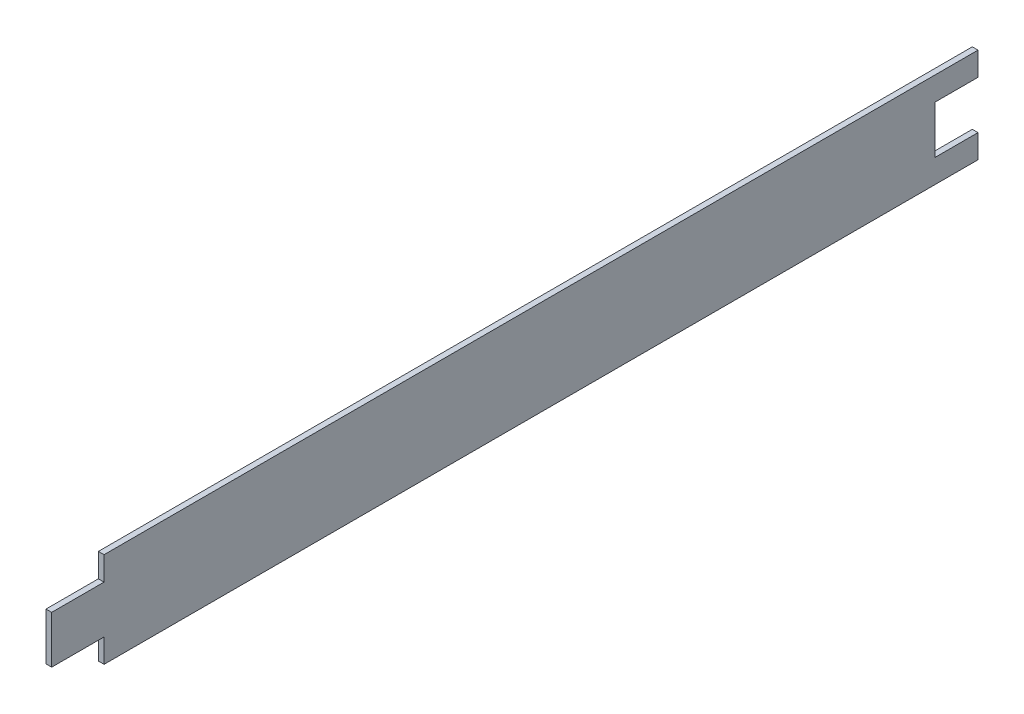
from build123d import *

# Parameters (mm, degrees)
ESQUISSE2_W        = 27.56942971
ESQUISSE2_H        = 25
BOSS_EXTRU_3_DEPTH = 3


with BuildPart() as part:
    # Esquisse2 → Boss.-Extru.3 (new body)
    with BuildSketch(Plane(origin=(0, 0, 0), x_dir=(0, 0, -1), z_dir=(1, 0, 0))):
        with Locations((-243.784714855, 0)):
            Rectangle(ESQUISSE2_W, ESQUISSE2_H)
        Polygon((230, 25), (-230, 25), (-230, 12.5), (-230, -12.5), (-230, -25), (230, -25), (230, -12.6), (207.351490585, -12.6), (207.351490585, 12.6), (230, 12.6), align=None)
    extrude(amount=BOSS_EXTRU_3_DEPTH)


solid = part.part
